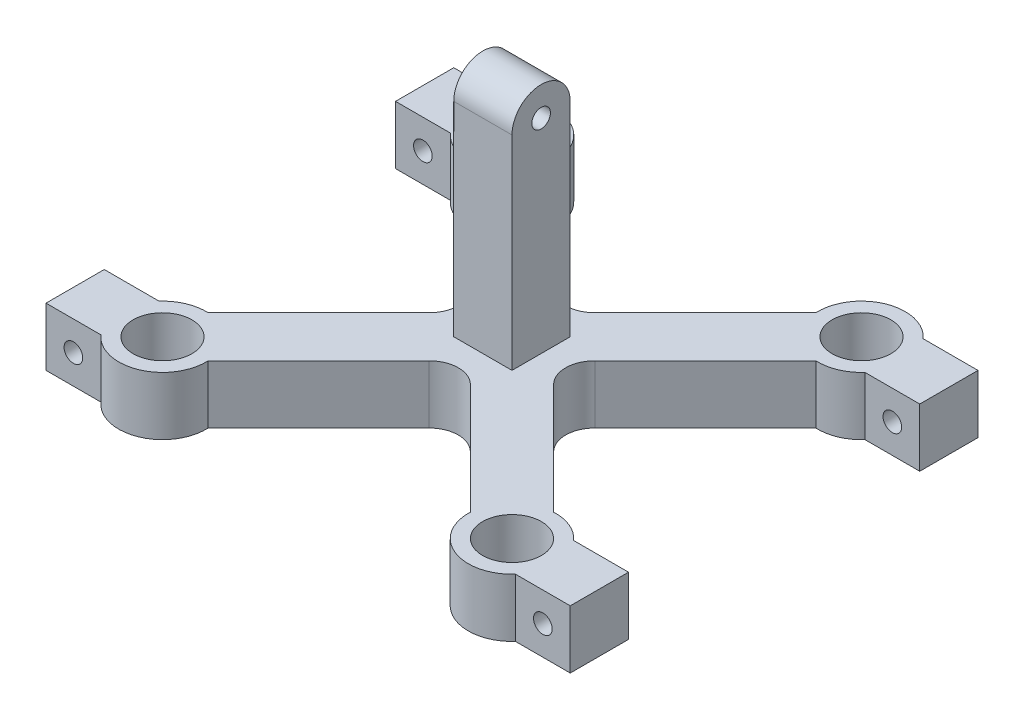
from build123d import *

# Parameters (mm, degrees)
SKETCH_1_R          = 5.05
EXTRUDE_1_DEPTH     = 10
SKETCH_2_W          = 10
SKETCH_2_H          = 10
EXTRUDE_2_DEPTH     = 40
FILLET_3_RADIUS     = 5
FILLET_3_LENGTH     = 10
SKETCH_3_R          = 1.6
CUT_EXTRUDE_1_DEPTH = 81.039052968
SKETCH_4_R          = 1.6
CUT_EXTRUDE_2_DEPTH = 99.900202224


with BuildPart() as part:
    # ｽｹｯﾁ1 → ﾎﾞｽ - 押し出し1 (new body)
    with BuildSketch(Plane(origin=(0, 0, 0), x_dir=(1, 0, 0), z_dir=(0, 1, 0))):
        with BuildLine():
            Line((3.535533906, -10.677312396), (22.508173367, -29.649951857))
            ThreePointArc((22.508173367, -29.649951857), (27.161016322, -36.941914122), (35.590169944, -35))
            Line((35.590169944, -35), (45, -35))
            Line((45, -35), (45, -25))
            Line((45, -25), (35.590169944, -25))
            ThreePointArc((35.590169944, -25), (32.90120994, -23.08386084), (29.649951857, -22.508173367))
            Line((29.649951857, -22.508173367), (10.677312396, -3.535533906))
            ThreePointArc((10.677312396, -3.535533906), (9.212846302, 0), (10.677312396, 3.535533906))
            Line((10.677312396, 3.535533906), (29.649951857, 22.508173367))
            ThreePointArc((29.649951857, 22.508173367), (32.90120994, 23.08386084), (35.590169944, 25))
            Line((35.590169944, 25), (45, 25))
            Line((45, 25), (45, 35))
            Line((45, 35), (35.590169944, 35))
            ThreePointArc((35.590169944, 35), (27.161016322, 36.941914122), (22.508173367, 29.649951857))
            Line((22.508173367, 29.649951857), (3.535533906, 10.677312396))
            ThreePointArc((3.535533906, 10.677312396), (0, 9.212846302), (-3.535533906, 10.677312396))
            Line((-3.535533906, 10.677312396), (-22.508173367, 29.649951857))
            ThreePointArc((-22.508173367, 29.649951857), (-27.161016322, 36.941914122), (-35.590169944, 35))
            Line((-35.590169944, 35), (-45, 35))
            Line((-45, 35), (-45, 25))
            Line((-45, 25), (-35.590169944, 25))
            ThreePointArc((-35.590169944, 25), (-32.90120994, 23.08386084), (-29.649951857, 22.508173367))
            Line((-29.649951857, 22.508173367), (-10.677312396, 3.535533906))
            ThreePointArc((-10.677312396, 3.535533906), (-9.212846302, 0), (-10.677312396, -3.535533906))
            Line((-10.677312396, -3.535533906), (-29.649951857, -22.508173367))
            ThreePointArc((-29.649951857, -22.508173367), (-32.90120994, -23.08386084), (-35.590169944, -25))
            Line((-35.590169944, -25), (-45, -25))
            Line((-45, -25), (-45, -35))
            Line((-45, -35), (-35.590169944, -35))
            ThreePointArc((-35.590169944, -35), (-27.161016322, -36.941914122), (-22.508173367, -29.649951857))
            Line((-22.508173367, -29.649951857), (-3.535533906, -10.677312396))
            ThreePointArc((-3.535533906, -10.677312396), (0, -9.212846302), (3.535533906, -10.677312396))
        make_face()
        with Locations(Location((30, 30, 0), (0, 0, 270))):
            Circle(SKETCH_1_R, mode=Mode.SUBTRACT)
        with Locations(Location((-30, 30, 0), (0, 0, 90))):
            Circle(SKETCH_1_R, mode=Mode.SUBTRACT)
        with Locations(Location((30, -30, 0), (0, 0, 90))):
            Circle(SKETCH_1_R, mode=Mode.SUBTRACT)
        with Locations(Location((-30, -30, 0), (0, 0, 270))):
            Circle(SKETCH_1_R, mode=Mode.SUBTRACT)
    extrude(amount=EXTRUDE_1_DEPTH)

    # ｽｹｯﾁ2 → ﾎﾞｽ - 押し出し2 (add)
    with BuildSketch(Plane(origin=(0, 10, 0), x_dir=(1, 0, 0), z_dir=(0, 1, 0))):
        Rectangle(SKETCH_2_W, SKETCH_2_H)
    extrude(amount=EXTRUDE_2_DEPTH)

    # ﾌｨﾚｯﾄ3: full round fillet: the end face becomes a half cylinder, R = half its width
    fillet_3_face = Plane((0, 50, 0), x_dir=(-1, 0, 0), z_dir=(0, 1, 0))  # on the end face: x along it, z out of the body
    fillet_3_slab = fillet_3_face.offset(-FILLET_3_RADIUS / 2) * Box(FILLET_3_LENGTH, 2 * FILLET_3_RADIUS, FILLET_3_RADIUS, mode=Mode.PRIVATE)  # the body's end, R deep
    fillet_3_round = Plane((0, 45, 0), x_dir=(0, 1, 0), z_dir=(-1, 0, 0)) * Cylinder(FILLET_3_RADIUS, FILLET_3_LENGTH, mode=Mode.PRIVATE)  # its axis R under the face
    add(fillet_3_slab - fillet_3_round, mode=Mode.SUBTRACT)

    # ｽｹｯﾁ3 → ｶｯﾄ - 押し出し1 (cut, through all)
    with BuildSketch(Plane(origin=(5, 0, 0), x_dir=(0, 0, -1), z_dir=(1, 0, 0))):
        with Locations((0, 45)):
            Circle(SKETCH_3_R)
    extrude(amount=-CUT_EXTRUDE_1_DEPTH, mode=Mode.SUBTRACT)

    # ｽｹｯﾁ4 → ｶｯﾄ - 押し出し2 (cut, through all)
    with BuildSketch(Plane.XY.offset(35)):
        with Locations((-40.295084972, 5)):
            Circle(SKETCH_4_R)
        with Locations((40.295084972, 5)):
            Circle(SKETCH_4_R)
    extrude(amount=-CUT_EXTRUDE_2_DEPTH, mode=Mode.SUBTRACT)


solid = part.part
